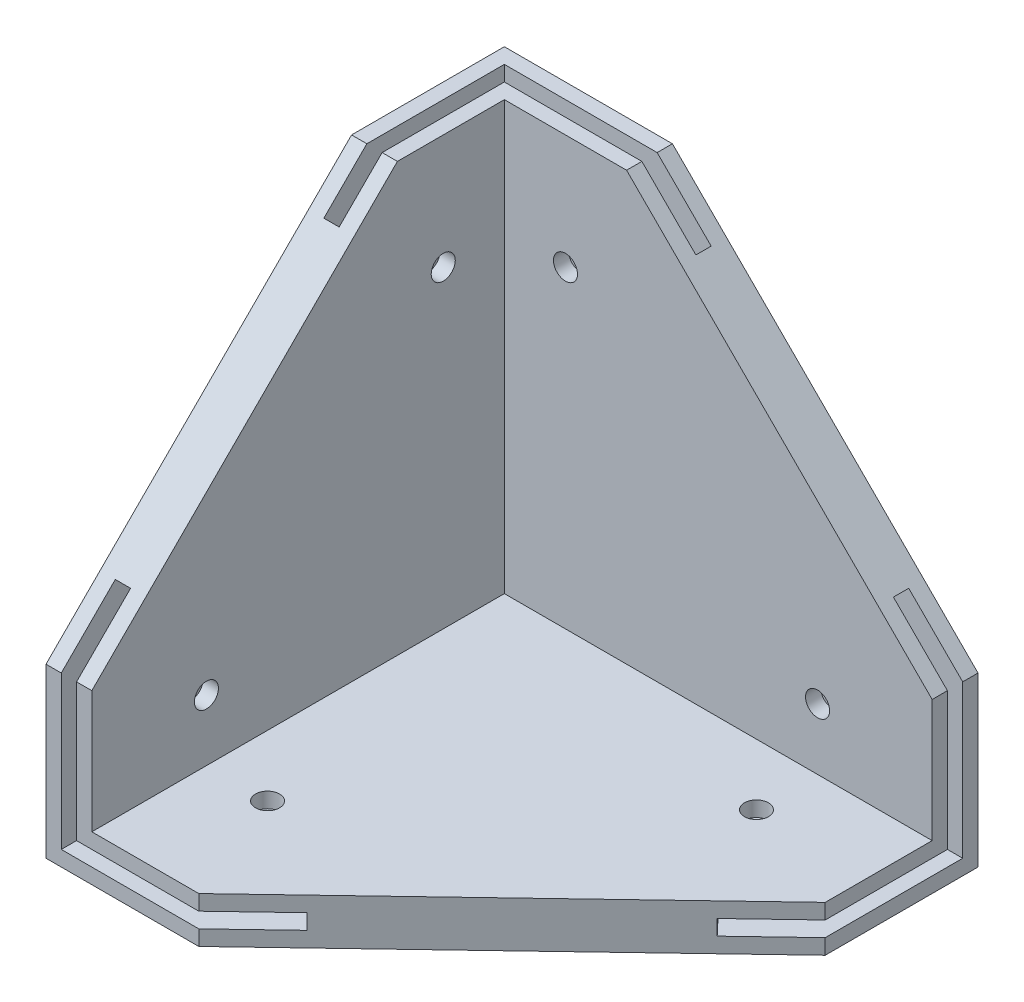
from build123d import *

# Parameters (mm, degrees)
BOSS_EXTRUDE1_DEPTH  = 2.54
BOSS_EXTRUDE2_DEPTH  = 2.54
BOSS_EXTRUDE3_DEPTH  = 2.54
SKETCH6_W            = 2.54
SKETCH6_H            = 76.2
BOSS_EXTRUDE4_DEPTH  = 76.2
CUT_EXTRUDE1_REACH   = 133.982
SKETCH8_W            = 2.54
SKETCH8_H            = 78.74
BOSS_EXTRUDE5_DEPTH  = 76.2
CUT_EXTRUDE2_REACH   = 133.982
SKETCH10_W           = 78.74
SKETCH10_H           = 2.54
BOSS_EXTRUDE6_DEPTH  = 76.2
CUT_EXTRUDE3_REACH   = 133.982
CUT_EXTRUDE5_DEPTH   = 132.982271537
CUT_EXTRUDE6_DEPTH   = 132.982271537
CUT_EXTRUDE9_DEPTH   = 76.2
BOSS_EXTRUDE7_DEPTH  = 7.62
BOSS_EXTRUDE8_DEPTH  = 5.08
BOSS_EXTRUDE9_DEPTH  = 5.08
SKETCH34_R           = 2
CUT_EXTRUDE11_DEPTH  = 12.7
SKETCH35_R           = 2
CUT_EXTRUDE13_DEPTH  = 12.7
SKETCH36_R           = 2
CUT_EXTRUDE14_DEPTH  = 12.7
BOSS_EXTRUDE10_REACH = 133.982
SKETCH37_W           = 25.4
SKETCH37_H           = 25.4
BOSS_EXTRUDE11_REACH = 133.982
SKETCH38_W           = 25.4
SKETCH38_H           = 25.4
SKETCH39_W           = 25.4
SKETCH39_H           = 25.4
BOSS_EXTRUDE12_DEPTH = 5.08


with BuildPart() as part:
    # Sketch1 → Boss-Extrude1 (new body)
    with BuildSketch(Plane.XY):
        Polygon((0, 76.2), (0, 0), (76.2, 0), (76.2, 25.4), (25.4, 76.2), align=None)
    extrude(amount=BOSS_EXTRUDE1_DEPTH)

    # Sketch3 → Boss-Extrude2 (add)
    with BuildSketch(Plane.ZY):
        Polygon((0, 76.2), (25.4, 76.2), (76.2, 25.4), (76.2, 0), (0, 0), align=None)
    extrude(amount=BOSS_EXTRUDE2_DEPTH)

    # Sketch5 → Boss-Extrude3 (add)
    with BuildSketch(Plane.XZ):
        Polygon((-2.54, 76.2), (-2.54, 0), (76.2, 0), (76.2, 25.4), (22.86, 76.2), align=None)
    extrude(amount=BOSS_EXTRUDE3_DEPTH)

    # Sketch6 → Boss-Extrude4 (add)
    with BuildSketch(Plane.XY):
        with Locations((3.81, 38.1)):
            Rectangle(SKETCH6_W, SKETCH6_H)
    extrude(amount=BOSS_EXTRUDE4_DEPTH)

    # Sketch7 → Cut-Extrude1 (cut, up to next)
    with BuildSketch(Plane(origin=(0, 0, 0), x_dir=(0, 0, -1), z_dir=(1, 0, 0)), mode=Mode.PRIVATE) as cut_extrude1_sk1:
        Polygon((-25.4, 76.2), (-76.2, 25.4), (-76.2, 76.2), align=None)
    cut_extrude1_tool1 = extrude(cut_extrude1_sk1.sketch, amount=CUT_EXTRUDE1_REACH, mode=Mode.PRIVATE) & part.part
    add(cut_extrude1_tool1.solids().sort_by_distance((0, 59.266667, 59.266667))[0], mode=Mode.SUBTRACT)

    # Sketch8 → Boss-Extrude5 (add)
    with BuildSketch(Plane(origin=(0, 0, 0), x_dir=(0, 0, -1), z_dir=(1, 0, 0))):
        with Locations((-6.35, 36.83)):
            Rectangle(SKETCH8_W, SKETCH8_H)
    extrude(amount=BOSS_EXTRUDE5_DEPTH)

    # Sketch9 → Cut-Extrude2 (cut, up to next)
    with BuildSketch(Plane.XY, mode=Mode.PRIVATE) as cut_extrude2_sk1:
        Polygon((76.2, 25.4), (25.4, 76.2), (76.2, 76.2), align=None)
    cut_extrude2_tool1 = extrude(cut_extrude2_sk1.sketch, amount=CUT_EXTRUDE2_REACH, mode=Mode.PRIVATE) & part.part
    add(cut_extrude2_tool1.solids().sort_by_distance((59.266667, 59.266667, 0))[0], mode=Mode.SUBTRACT)

    # Sketch10 → Boss-Extrude6 (add)
    with BuildSketch(Plane.XY):
        with Locations((36.83, 3.81)):
            Rectangle(SKETCH10_W, SKETCH10_H)
    extrude(amount=BOSS_EXTRUDE6_DEPTH)

    # Sketch11 → Cut-Extrude3 (cut, up to next)
    with BuildSketch(Plane(origin=(0, 0, 0), x_dir=(1, 0, 0), z_dir=(0, 1, 0)), mode=Mode.PRIVATE) as cut_extrude3_sk1:
        Polygon((22.86, -76.2), (76.2, -25.4), (76.2, -76.2), align=None)
    cut_extrude3_tool1 = extrude(cut_extrude3_sk1.sketch, amount=CUT_EXTRUDE3_REACH, mode=Mode.PRIVATE) & part.part
    add(cut_extrude3_tool1.solids().sort_by_distance((58.42, 0, 59.266667))[0], mode=Mode.SUBTRACT)

    # Sketch12 → Cut-Extrude5 (cut, through all)
    with BuildSketch(Plane(origin=(0, 0, 0), x_dir=(0, 0, -1), z_dir=(1, 0, 0))):
        Polygon((-5.08, 5.08), (-5.08, 2.54), (-7.62, 2.54), (-7.62, 0), (-2.54, 0), (-2.54, 5.08), align=None)
    extrude(amount=CUT_EXTRUDE5_DEPTH, mode=Mode.SUBTRACT)

    # Sketch13 → Cut-Extrude6 (cut, through all)
    with BuildSketch(Plane(origin=(0, 0, 0), x_dir=(1, 0, 0), z_dir=(0, 1, 0))):
        Polygon((0, -2.54), (0, -7.62), (2.54, -7.62), (2.54, -5.08), (5.08, -5.08), (5.08, -2.54), align=None)
    extrude(amount=CUT_EXTRUDE6_DEPTH, mode=Mode.SUBTRACT)

    # Sketch15 → Cut-Extrude9 (cut)
    with BuildSketch(Plane.XY.offset(2.54)):
        Polygon((2.54, 5.08), (0, 5.08), (0, 0), (5.08, 0), (5.08, 2.54), (2.54, 2.54), align=None)
    extrude(amount=CUT_EXTRUDE9_DEPTH, mode=Mode.SUBTRACT)


with BuildPart() as cut_extrude9_piece_1:
    # of the separate pieces the step leaves, piece 1, a body of its own (cut_extrude9_pieces)
    add(part.part.solids().sort_by_distance((0, 0, 2.54))[0])



with BuildPart() as cut_extrude9_piece_2:
    # of the separate pieces the step leaves, piece 2, a body of its own (cut_extrude9_pieces)
    add(part.part.solids().sort_by_distance((2.54, 2.54, 76.2))[0])


with BuildPart() as cut_extrude9_piece_1_1:
    add(cut_extrude9_piece_1.part)

    add(cut_extrude9_piece_2.part)  # Boss-Extrude7 merges Cut-Extrude9 piece 2
    # Sketch17 → Boss-Extrude7 (add)
    with BuildSketch(Plane(origin=(0, 0, 0), x_dir=(-1, 0, 0), z_dir=(0, 0, -1))):
        Polygon((-67.219743879, 34.380256121), (-34.380256121, 67.219743879), (-30.788153673, 63.627641431), (-63.627641431, 30.788153673), align=None)
    extrude(amount=-BOSS_EXTRUDE7_DEPTH)

    # Sketch18 → Boss-Extrude8 (add)
    with BuildSketch(Plane(origin=(0, 0, 0), x_dir=(1, 0, 0), z_dir=(0, 1, 0))):
        Polygon((32.056551724, -67.44137931), (67.003448276, -34.15862069), (63.5, -30.48), (28.553103448, -63.762758621), align=None)
    extrude(amount=BOSS_EXTRUDE8_DEPTH)

    # Sketch19 → Boss-Extrude9 (add)
    with BuildSketch(Plane(origin=(0, 0, 0), x_dir=(0, 0, -1), z_dir=(1, 0, 0))):
        Polygon((-32.545001849, 69.054998151), (-67.219743879, 34.380256121), (-63.627641431, 30.788153673), (-28.9528994, 65.462895703), align=None)
    extrude(amount=BOSS_EXTRUDE9_DEPTH)

    # Sketch34 → Cut-Extrude11 (cut, symmetric)
    with BuildSketch(Plane(origin=(0, 0, 0), x_dir=(0, 0, -1), z_dir=(1, 0, 0))):
        with Locations((-17.78, 57.15)):
            Circle(SKETCH34_R)
        with Locations((-57.15, 15.24)):
            Circle(SKETCH34_R)
    extrude(amount=CUT_EXTRUDE11_DEPTH, both=True, mode=Mode.SUBTRACT)

    # Sketch35 → Cut-Extrude13 (cut, symmetric)
    with BuildSketch(Plane(origin=(0, 0, 0), x_dir=(1, 0, 0), z_dir=(0, 1, 0))):
        with Locations(Location((15.24, -57.15, 0), (0, 0, 270))):
            Circle(SKETCH35_R)
        with Locations(Location((57.15, -17.78, 0), (0, 0, 270))):
            Circle(SKETCH35_R)
    extrude(amount=CUT_EXTRUDE13_DEPTH, both=True, mode=Mode.SUBTRACT)

    # Sketch36 → Cut-Extrude14 (cut, symmetric)
    with BuildSketch(Plane.XY):
        with Locations((57.15, 15.24)):
            Circle(SKETCH36_R)
        with Locations((15.24, 57.15)):
            Circle(SKETCH36_R)
    extrude(amount=CUT_EXTRUDE14_DEPTH, both=True, mode=Mode.SUBTRACT)

    # Boss-Extrude10: up to this face of the body (flat: up to its plane)
    boss_extrude10_end = Plane(cut_extrude9_piece_1_1.part.faces().sort_by_distance((34.248017182, 34.248017182, 7.62))[0])
    # Sketch37 → Boss-Extrude10 (add, up to the picked face)
    with BuildSketch(Plane.XY, mode=Mode.PRIVATE) as boss_extrude10_sk1:
        with Locations((12.7, 12.7)):
            Rectangle(SKETCH37_W, SKETCH37_H)
    boss_extrude10_tool1 = split(extrude(boss_extrude10_sk1.sketch, amount=BOSS_EXTRUDE10_REACH, mode=Mode.PRIVATE), bisect_by=boss_extrude10_end, keep=Keep.BOTH, mode=Mode.PRIVATE)
    add(boss_extrude10_tool1.solids().sort_by(Axis((12.7, 12.7, 0), (0, 0, 1)))[0])

    # Boss-Extrude11: up to this face of the body (flat: up to its plane)
    boss_extrude11_end = Plane(cut_extrude9_piece_1_1.part.faces().sort_by_distance((33.784338957, 5.08, 35.218329504))[0])
    # Sketch38 → Boss-Extrude11 (add, up to the picked face)
    with BuildSketch(Plane(origin=(0, 0, 0), x_dir=(1, 0, 0), z_dir=(0, 1, 0)), mode=Mode.PRIVATE) as boss_extrude11_sk1:
        with Locations((12.7, -15.24)):
            Rectangle(SKETCH38_W, SKETCH38_H)
    boss_extrude11_tool1 = split(extrude(boss_extrude11_sk1.sketch, amount=BOSS_EXTRUDE11_REACH, mode=Mode.PRIVATE), bisect_by=boss_extrude11_end, keep=Keep.BOTH, mode=Mode.PRIVATE)
    add(boss_extrude11_tool1.solids().sort_by(Axis((12.7, 0, 15.24), (0, 1, 0)))[0])

    # Sketch39 → Boss-Extrude12 (add)
    with BuildSketch(Plane(origin=(0, 0, 0), x_dir=(0, 0, -1), z_dir=(1, 0, 0))):
        with Locations((-15.24, 12.7)):
            Rectangle(SKETCH39_W, SKETCH39_H)
    extrude(amount=BOSS_EXTRUDE12_DEPTH)


solid = cut_extrude9_piece_1_1.part
